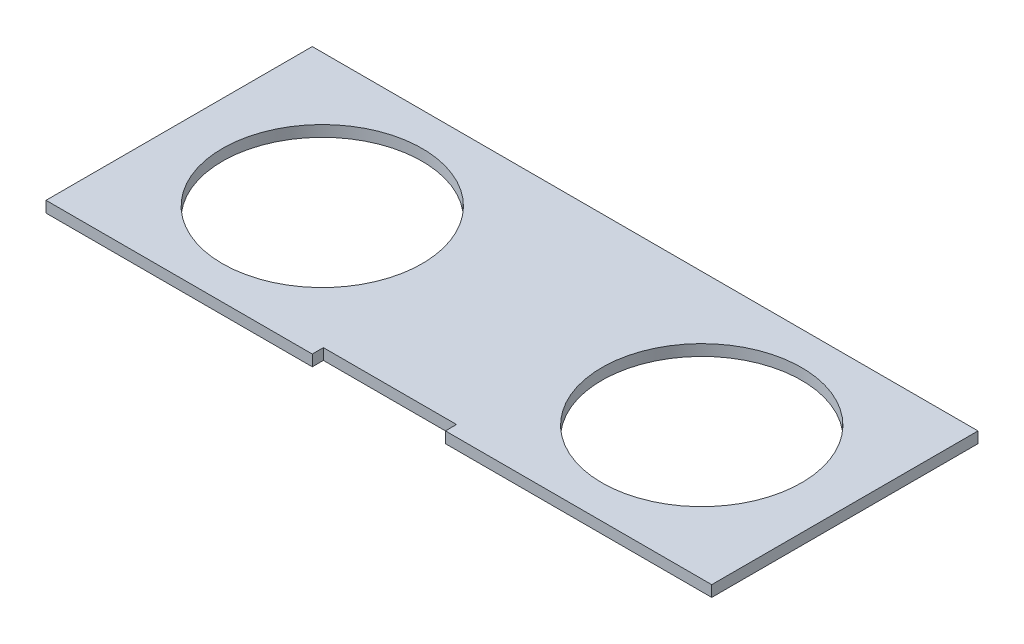
from build123d import *

# Parameters (mm, degrees)
SKETCH1_W           = 300
SKETCH1_H           = 120
BOSS_EXTRUDE1_DEPTH = 5
SKETCH2_R           = 45
SKETCH2_W           = 60
SKETCH2_H           = 5
CUT_EXTRUDE1_DEPTH  = 5


with BuildPart() as part:
    # Sketch1 → Boss-Extrude1 (new body)
    with BuildSketch(Plane(origin=(0, 0, 0), x_dir=(1, 0, 0), z_dir=(0, 1, 0))):
        with Locations((-150, 60)):
            Rectangle(SKETCH1_W, SKETCH1_H)
    extrude(amount=BOSS_EXTRUDE1_DEPTH)

    # Sketch2 → Cut-Extrude1 (cut)
    with BuildSketch(Plane(origin=(0, 5, 0), x_dir=(1, 0, 0), z_dir=(0, 1, 0))):
        with Locations(Location((-64.5, 60, 0), (0, 0, 270))):
            Circle(SKETCH2_R)
        with Locations(Location((-235.5, 60, 0), (0, 0, 270))):
            Circle(SKETCH2_R)
        with Locations((-150, 2.5)):
            Rectangle(SKETCH2_W, SKETCH2_H)
    extrude(amount=-CUT_EXTRUDE1_DEPTH, mode=Mode.SUBTRACT)


solid = part.part
